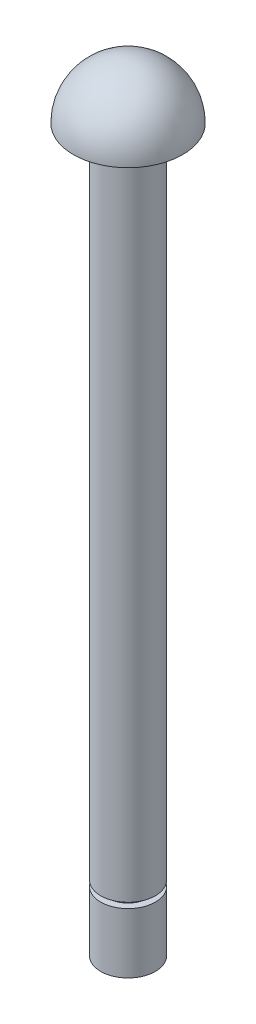
from build123d import *

# Parameters (mm, degrees)
SKETCH1_R           = 2.5
BOSS_EXTRUDE1_DEPTH = 66
SKETCH8_W           = 0.625
SKETCH8_H           = 0.5


with BuildPart() as part:
    # Sketch1 → Boss-Extrude1 (new body)
    with BuildSketch(Plane(origin=(0, 0, 0), x_dir=(1, 0, 0), z_dir=(0, 1, 0))):
        with Locations(Location((0, 0, 0), (0, 0, 270))):
            Circle(SKETCH1_R)
    extrude(amount=BOSS_EXTRUDE1_DEPTH)

    # Sketch3 → Revolve1 (revolve)
    with BuildSketch(Plane(origin=(0, 0, 0), x_dir=(0, 0, -1), z_dir=(1, 0, 0))):
        with BuildLine():
            Line((0, 66), (0, 71))
            ThreePointArc((0, 71), (3.535533906, 69.535533906), (5, 66))
            Line((5, 66), (0, 66))
        make_face()
    revolve(axis=Axis((0, 66, 0), (0, 1, 0)))

    # Sketch8 → Cut-Revolve3 (revolve, cut)
    with BuildSketch(Plane(origin=(0, 66, 0), x_dir=(0, 0, -1), z_dir=(-1, 0, 0)), mode=Mode.PRIVATE) as cut_revolve3_sk:
        with Locations((2.1875, 60.25)):
            Rectangle(SKETCH8_W, SKETCH8_H)
    revolve(cut_revolve3_sk.sketch.rotate(Axis((0, 66, 0), (0, -1, 0)), 180), axis=Axis((0, 66, 0), (0, -1, 0)), mode=Mode.SUBTRACT)


solid = part.part
